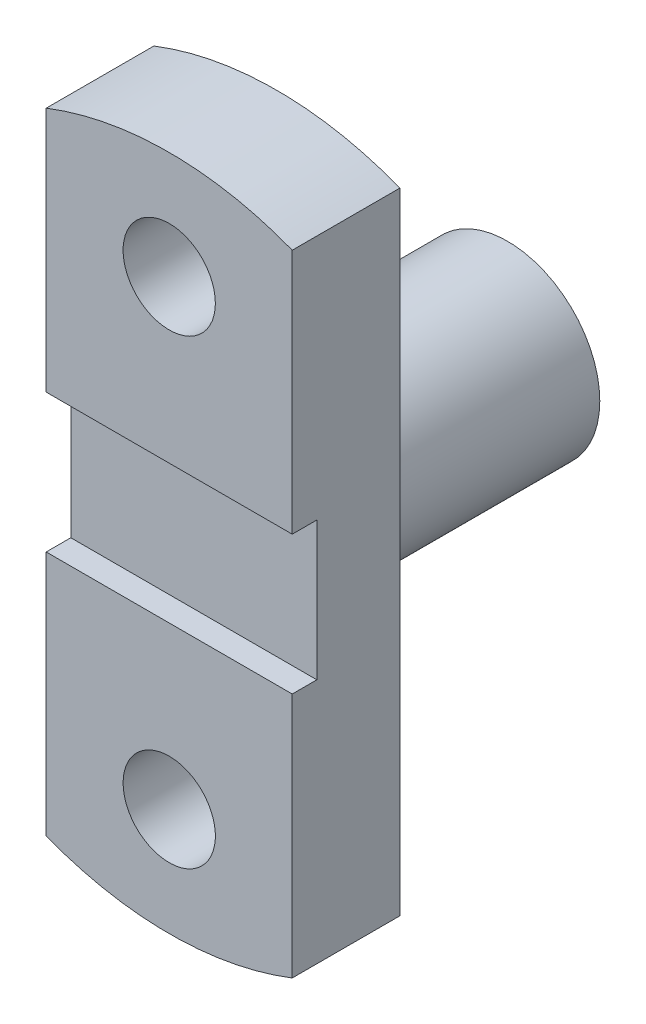
from build123d import *

# Parameters (mm, degrees)
SKETCH1_R           = 15
BOSS_EXTRUDE1_DEPTH = 35
SKETCH2_W           = 80
SKETCH2_H           = 45
CUT_EXTRUDE1_DEPTH  = 8
SKETCH3_R           = 30
BOSS_EXTRUDE2_DEPTH = 75


with BuildPart() as part:
    # Sketch1 → Boss-Extrude1 (new body)
    with BuildSketch(Plane.XY):
        with BuildLine():
            Line((-40, 102.46950766), (-40, -102.46950766))
            ThreePointArc((-40, -102.46950766), (0, -110), (40, -102.46950766))
            Line((40, -102.46950766), (40, 102.46950766))
            ThreePointArc((40, 102.46950766), (0, 110), (-40, 102.46950766))
        make_face()
        with Locations((0, 75)):
            Circle(SKETCH1_R, mode=Mode.SUBTRACT)
        with Locations(Location((0, -75, 0), (0, 0, 180))):
            Circle(SKETCH1_R, mode=Mode.SUBTRACT)
    extrude(amount=BOSS_EXTRUDE1_DEPTH)

    # Sketch2 → Cut-Extrude1 (cut)
    with BuildSketch(Plane.XY.offset(35)):
        Rectangle(SKETCH2_W, SKETCH2_H)
    extrude(amount=-CUT_EXTRUDE1_DEPTH, mode=Mode.SUBTRACT)

    # Sketch3 → Boss-Extrude2 (add)
    with BuildSketch(Plane(origin=(0, 0, 0), x_dir=(-1, 0, 0), z_dir=(0, 0, -1))):
        with Locations(Location((0, 0, 0), (0, 0, 180))):
            Circle(SKETCH3_R)
    extrude(amount=BOSS_EXTRUDE2_DEPTH)


solid = part.part
